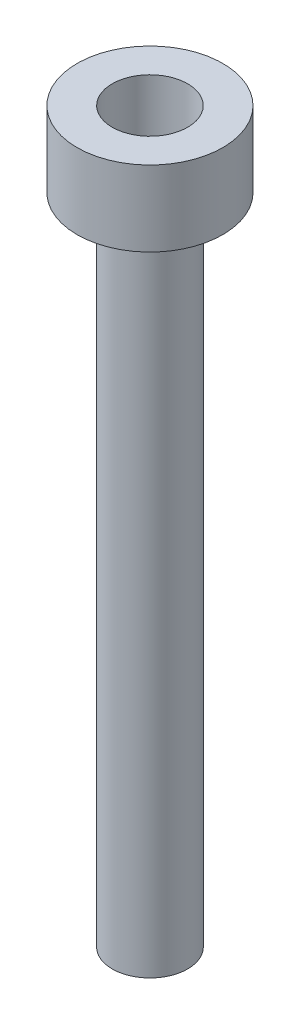
from build123d import *

# Parameters (mm, degrees)
SKETCH_1_R          = 2.9
EXTRUDE_1_DEPTH     = 3
SKETCH_2_R          = 1.5
CUT_EXTRUDE_1_DEPTH = 3
SKETCH_5_R          = 1.5
EXTRUDE_2_DEPTH     = 26


with BuildPart() as part:
    # 草图1 → 凸台-拉伸1 (new body)
    with BuildSketch(Plane(origin=(0, 0, 0), x_dir=(1, 0, 0), z_dir=(0, 1, 0))):
        with Locations(Location((0, 0, 0), (0, 0, 270))):
            Circle(SKETCH_1_R)
    extrude(amount=EXTRUDE_1_DEPTH)

    # 草图2 → 切除-拉伸1 (cut)
    with BuildSketch(Plane(origin=(0, 3, 0), x_dir=(1, 0, 0), z_dir=(0, 1, 0))):
        with Locations(Location((0, 0, 0), (0, 0, 270))):
            Circle(SKETCH_2_R)
    extrude(amount=-CUT_EXTRUDE_1_DEPTH, mode=Mode.SUBTRACT)


with BuildPart() as body_2:
    # 草图5 → 凸台-拉伸2 (new body)
    with BuildSketch(Plane.XZ):
        with Locations(Location((0, 0, 0), (0, 0, 90))):
            Circle(SKETCH_5_R)
    extrude(amount=EXTRUDE_2_DEPTH)


solid = Compound([part.part, body_2.part])
